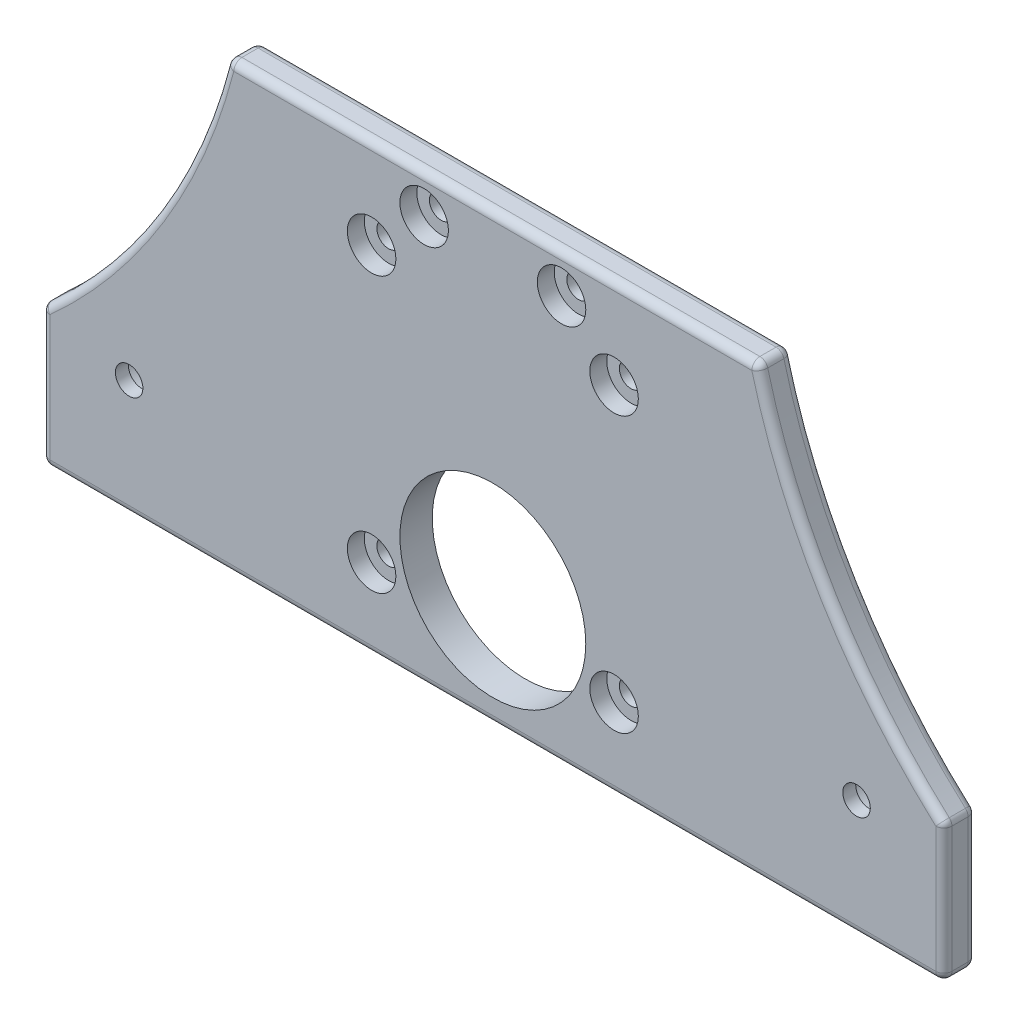
from build123d import *

# Parameters (mm, degrees)
ESQUISSE1_R                                        = 1.2
ESQUISSE1_R_2                                      = 11.5
ESQUISSE1_R_3                                      = 1
BOSS_EXTRU_1_DEPTH                                 = 4
CHAMBRAGE_POUR_VIS_T_TE_RONDE_BOMB_E_M_D           = 2.9
CHAMBRAGE_POUR_VIS_T_TE_RONDE_BOMB_E_M_CBORE_D     = 6
CHAMBRAGE_POUR_VIS_T_TE_RONDE_BOMB_E_M_CBORE_DEPTH = 2.1
CONG_1_R                                           = 1
D_GAGEMENT_M34_D                                   = 3.4
CHAMBRAGE_POUR_VIS_T_TE_RONDE_BOMB_2_D             = 2.9
CHAMBRAGE_POUR_VIS_T_TE_RONDE_BOMB_2_CBORE_D       = 6
CHAMBRAGE_POUR_VIS_T_TE_RONDE_BOMB_2_CBORE_DEPTH   = 2.1
CHAMBRAGE_POUR_VIS_T_TE_RONDE_BOMB_3_D             = 3.4
CHAMBRAGE_POUR_VIS_T_TE_RONDE_BOMB_3_CBORE_D       = 7
CHAMBRAGE_POUR_VIS_T_TE_RONDE_BOMB_3_CBORE_DEPTH   = 2.4


with BuildPart() as part:
    # Esquisse1 → Boss.-Extru.1 (new body)
    with BuildSketch(Plane.XY):
        with BuildLine():
            Line((55.801816314, -15.329976162), (-55.801816314, -15.329976162))
            Line((-55.801816314, -15.329976162), (-55.801816314, 1.670023838))
            ThreePointArc((-55.801816314, 1.670023838), (-41.441556985, 18.934224014), (-32.822029076, 39.670023838))
            Line((-32.822029076, 39.670023838), (32.822029076, 39.670023838))
            ThreePointArc((32.822029076, 39.670023838), (41.441556985, 18.934224014), (55.801816314, 1.670023838))
            Line((55.801816314, 1.670023838), (55.801816314, -15.329976162))
        make_face()
        with Locations((15, -5.410480756)):
            Circle(ESQUISSE1_R, mode=Mode.SUBTRACT)
        with Locations((15, 28.589519244)):
            Circle(ESQUISSE1_R, mode=Mode.SUBTRACT)
        with Locations(Location((-15, -5.410480756, 0), (0, 0, 180))):
            Circle(ESQUISSE1_R, mode=Mode.SUBTRACT)
        with Locations(Location((-15, 28.589519244, 0), (0, 0, 180))):
            Circle(ESQUISSE1_R, mode=Mode.SUBTRACT)
        with Locations((0, -0.910480756)):
            Circle(ESQUISSE1_R_2, mode=Mode.SUBTRACT)
        with Locations((45, -0.910480756)):
            Circle(ESQUISSE1_R_3, mode=Mode.SUBTRACT)
        with Locations((-45, -0.910480756)):
            Circle(ESQUISSE1_R_3, mode=Mode.SUBTRACT)
        with Locations((-8.5, 34.889519244)):
            Circle(ESQUISSE1_R_3, mode=Mode.SUBTRACT)
        with Locations((8.5, 34.889519244)):
            Circle(ESQUISSE1_R_3, mode=Mode.SUBTRACT)
    extrude(amount=BOSS_EXTRU_1_DEPTH)

    # Chambrage pour vis _ t_te ronde bomb_e M (through all)
    with Locations(Plane.XY.offset(4)):
        with Locations((-15, 28.589519244), (15, 28.589519244), (15, -5.410480756), (-15, -5.410480756)):
            CounterBoreHole(CHAMBRAGE_POUR_VIS_T_TE_RONDE_BOMB_E_M_D / 2, CHAMBRAGE_POUR_VIS_T_TE_RONDE_BOMB_E_M_CBORE_D / 2, CHAMBRAGE_POUR_VIS_T_TE_RONDE_BOMB_E_M_CBORE_DEPTH)

    # Congé1
    cong_1_edges = [part.edges().sort_by_distance(p)[0] for p in [
        (-32.822029076, 39.670023838, 2),
        (32.822029076, 39.670023838, 2),
        (55.801816314, 1.670023838, 2),
        (55.801816314, -15.329976162, 2),
        (-55.801816314, -15.329976162, 2),
        (-55.801816314, 1.670023838, 2),
        (0, -15.329976162, 4),
        (55.801816314, -6.829976162, 4),
        (41.441556985, 18.934224014, 4),
        (0, 39.670023838, 4),
        (-41.441556985, 18.934224014, 4),
        (0, 39.670023838, 0),
        (41.441556985, 18.934224014, 0),
        (55.801816314, -6.829976162, 0),
        (0, -15.329976162, 0),
        (-55.801816314, -6.829976162, 0),
        (-41.441556985, 18.934224014, 0),
        (-55.801816314, -6.829976162, 4),
    ]]
    fillet(cong_1_edges, radius=CONG_1_R)

    # Dégagement M34 (through all)
    with Locations(Plane.XY.offset(4)):
        with Locations((-45, -0.910480756), (45, -0.910480756)):
            Hole(D_GAGEMENT_M34_D / 2)

    # Chambrage pour vis _ t_te ronde bomb 2 (through all)
    with Locations(Plane.XY.offset(4)):
        with Locations((-8.5, 34.889519244), (8.5, 34.889519244)):
            CounterBoreHole(CHAMBRAGE_POUR_VIS_T_TE_RONDE_BOMB_2_D / 2, CHAMBRAGE_POUR_VIS_T_TE_RONDE_BOMB_2_CBORE_D / 2, CHAMBRAGE_POUR_VIS_T_TE_RONDE_BOMB_2_CBORE_DEPTH)

    # Chambrage pour vis _ t_te ronde bomb 3 (through all)
    with Locations(Plane(origin=(0, 0, 0), x_dir=(-1, 0, 0), z_dir=(0, 0, -1))):
        with Locations((45, -0.910480756), (-45, -0.910480756)):
            CounterBoreHole(CHAMBRAGE_POUR_VIS_T_TE_RONDE_BOMB_3_D / 2, CHAMBRAGE_POUR_VIS_T_TE_RONDE_BOMB_3_CBORE_D / 2, CHAMBRAGE_POUR_VIS_T_TE_RONDE_BOMB_3_CBORE_DEPTH)


solid = part.part
